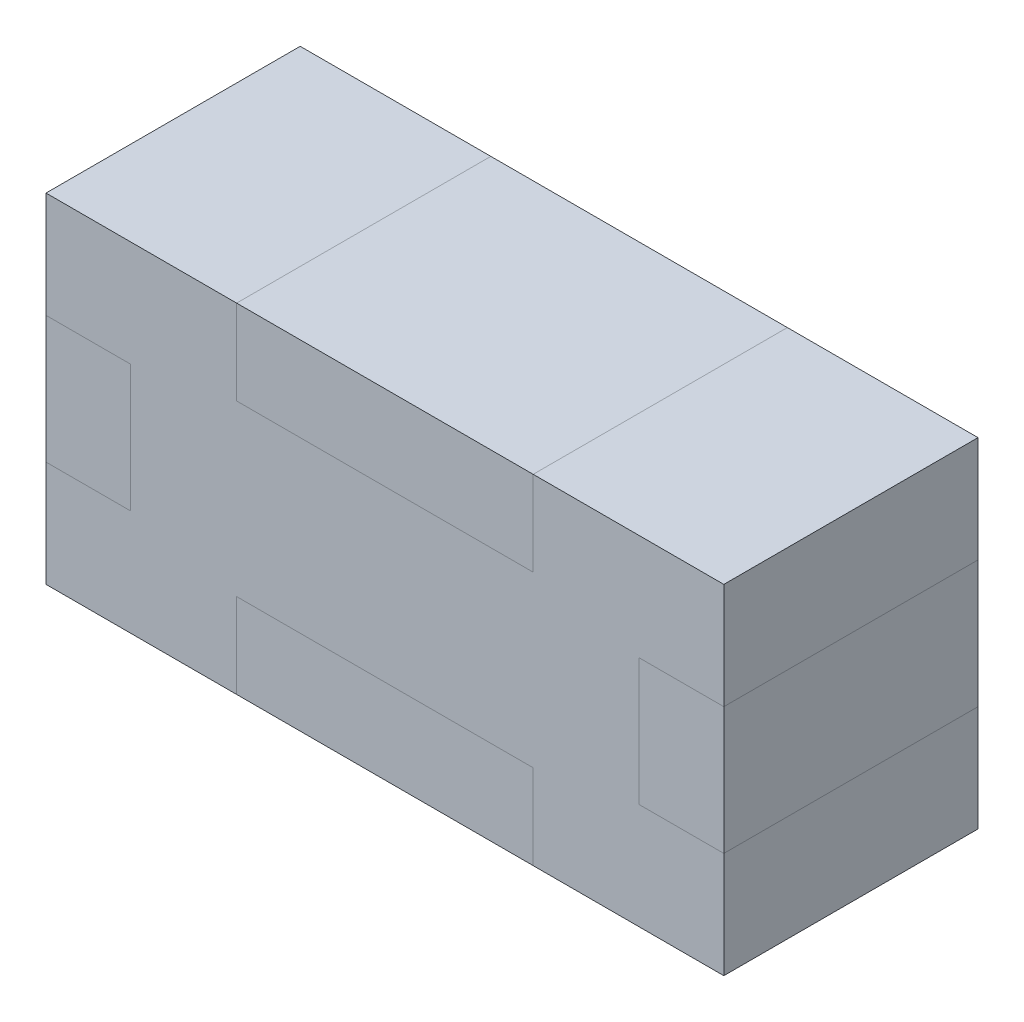
from build123d import *

# Parameters (mm, degrees)
SKETCH1_W             = 1.6
SKETCH1_H             = 0.8
BOSS_EXTRUDE1_DEPTH   = 0.6
SKETCH2_W             = 0.7
SKETCH2_H             = 0.200058326
SKETCH2_W_2           = 0.2
SKETCH2_H_2           = 0.3
CUT_EXTRUDE1_DEPTH    = 0.6
SKETCH2_4_W           = 0.7
SKETCH2_4_H           = 0.200058326
BOSS_EXTRUDE2_DEPTH   = 0.6
SKETCH2_4_W_2         = 0.2
SKETCH2_4_H_2         = 0.3
BOSS_EXTRUDE2_2_DEPTH = 0.6
BOSS_EXTRUDE2_3_DEPTH = 0.6
BOSS_EXTRUDE2_4_DEPTH = 0.6


with BuildPart() as part:
    # Sketch1 → Boss-Extrude1 (new body)
    with BuildSketch(Plane.XY):
        Rectangle(SKETCH1_W, SKETCH1_H)
    extrude(amount=BOSS_EXTRUDE1_DEPTH)

    # Sketch2 → Cut-Extrude1 (cut)
    with BuildSketch(Plane.XY.offset(0.6)):
        with Locations((0, -0.299970837)):
            Rectangle(SKETCH2_W, SKETCH2_H)
        with Locations((-0.7, 0)):
            Rectangle(SKETCH2_W_2, SKETCH2_H_2)
        with Locations((0, 0.299970837)):
            Rectangle(SKETCH2_W, SKETCH2_H)
        with Locations((0.7, 0)):
            Rectangle(SKETCH2_W_2, SKETCH2_H_2)
    extrude(amount=-CUT_EXTRUDE1_DEPTH, mode=Mode.SUBTRACT)


with BuildPart() as body_2:
    # Sketch2<4> → Boss-Extrude2 (new body)
    with BuildSketch(Plane.XY.offset(0.6)):
        with Locations((0, -0.299970837)):
            Rectangle(SKETCH2_4_W, SKETCH2_4_H)
    extrude(amount=-BOSS_EXTRUDE2_DEPTH)


with BuildPart() as body_3:
    # Sketch2<4> → Boss-Extrude2 2 (new body)
    with BuildSketch(Plane.XY.offset(0.6)):
        with Locations((-0.7, 0)):
            Rectangle(SKETCH2_4_W_2, SKETCH2_4_H_2)
    extrude(amount=-BOSS_EXTRUDE2_2_DEPTH)


with BuildPart() as body_4:
    # Sketch2<4> → Boss-Extrude2 3 (new body)
    with BuildSketch(Plane.XY.offset(0.6)):
        with Locations((0, 0.299970837)):
            Rectangle(SKETCH2_4_W, SKETCH2_4_H)
    extrude(amount=-BOSS_EXTRUDE2_3_DEPTH)


with BuildPart() as body_5:
    # Sketch2<4> → Boss-Extrude2 4 (new body)
    with BuildSketch(Plane.XY.offset(0.6)):
        with Locations((0.7, 0)):
            Rectangle(SKETCH2_4_W_2, SKETCH2_4_H_2)
    extrude(amount=-BOSS_EXTRUDE2_4_DEPTH)


solid = Compound([part.part, body_2.part, body_3.part, body_4.part, body_5.part])
